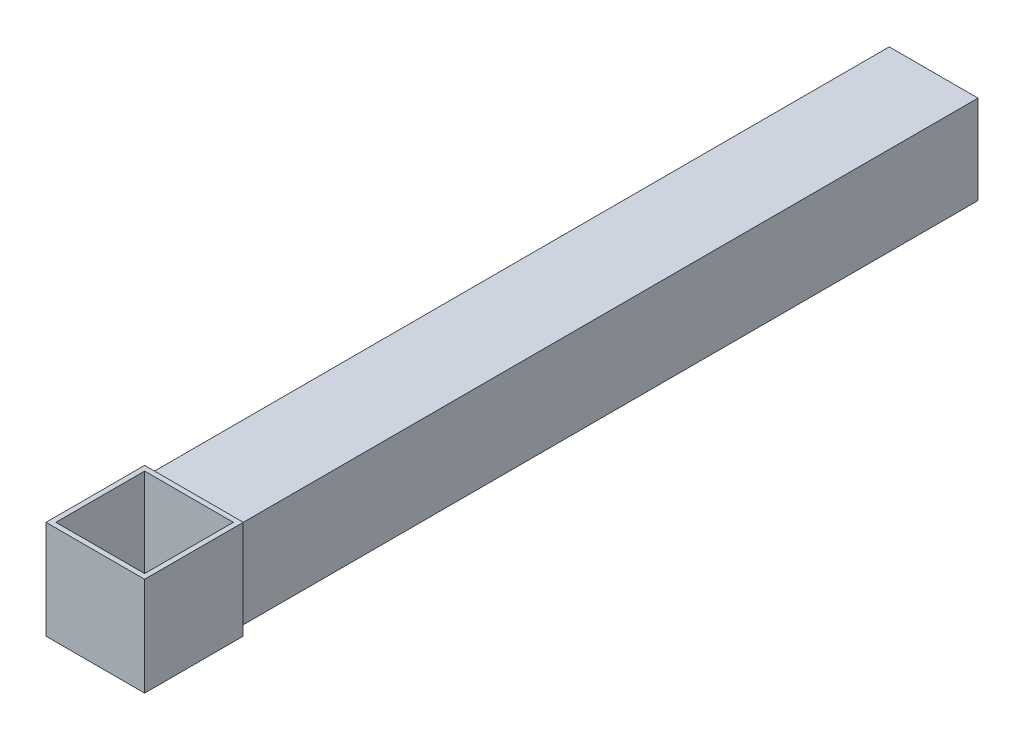
from build123d import *

# Parameters (mm, degrees)
SKETCH1_W                = 36
SKETCH1_H                = 36
BOSS_EXTRUDE1_DEPTH      = 300
BOSS_EXTRUDE2_DEPTH      = 20
BOSS_EXTRUDE2_DEPTH_BACK = 20
SKETCH2_W                = 40
SKETCH2_H                = 40
SKETCH2_W_2              = 36
SKETCH2_H_2              = 36


with BuildPart() as part:
    # Sketch1 → Boss-Extrude1 (new body)
    with BuildSketch(Plane.XY):
        Rectangle(SKETCH1_W, SKETCH1_H)
    extrude(amount=BOSS_EXTRUDE1_DEPTH)

    # Sketch2 → Boss-Extrude2 (add, two sides: drawn at the far end of the back side and taken through both)
    with BuildSketch(Plane(origin=(0, 0, 0), x_dir=(1, 0, 0), z_dir=(0, 1, 0)).offset(-BOSS_EXTRUDE2_DEPTH_BACK)):
        with Locations((0, -320)):
            Rectangle(SKETCH2_W, SKETCH2_H)
        with Locations((0, -320)):
            Rectangle(SKETCH2_W_2, SKETCH2_H_2, mode=Mode.SUBTRACT)
    extrude(amount=BOSS_EXTRUDE2_DEPTH + BOSS_EXTRUDE2_DEPTH_BACK)


solid = part.part
